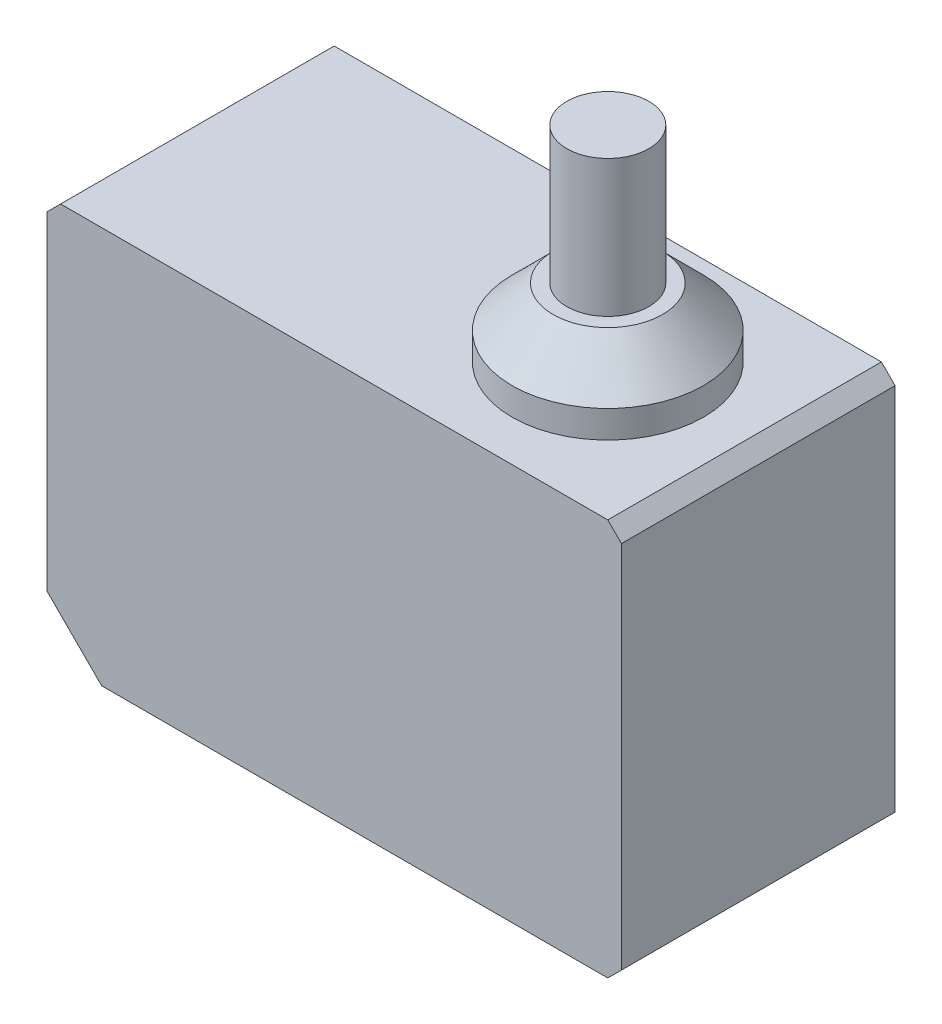
from build123d import *

# Parameters (mm, degrees)
SKETCH1_W           = 42
SKETCH1_H           = 29
BOSS_EXTRUDE1_DEPTH = 20
CHAMFER1_SIZE       = 4
CHAMFER2_SIZE       = 1
CHAMFER3_SIZE       = 1
SKETCH4_R           = 7
BOSS_EXTRUDE2_DEPTH = 5
CHAMFER4_SIZE       = 3
SKETCH5_R           = 3
BOSS_EXTRUDE3_DEPTH = 10


with BuildPart() as part:
    # Sketch1 → Boss-Extrude1 (new body)
    with BuildSketch(Plane.XY):
        with Locations((21, 14.5)):
            Rectangle(SKETCH1_W, SKETCH1_H)
    extrude(amount=BOSS_EXTRUDE1_DEPTH)

    # Chamfer1
    chamfer1_edges = [part.edges().sort_by_distance(p)[0] for p in [
        (0, 0, 10),
    ]]
    chamfer(chamfer1_edges, length=CHAMFER1_SIZE)

    # Chamfer2
    chamfer2_edges = [part.edges().sort_by_distance(p)[0] for p in [
        (0, 29, 10),
        (42, 29, 10),
    ]]
    chamfer(chamfer2_edges, length=CHAMFER2_SIZE)

    # Chamfer3
    chamfer3_edges = [part.edges().sort_by_distance(p)[0] for p in [
        (42, 0, 10),
    ]]
    chamfer(chamfer3_edges, length=CHAMFER3_SIZE)

    # Sketch4 → Boss-Extrude2 (add)
    with BuildSketch(Plane(origin=(0, 29, 0), x_dir=(1, 0, 0), z_dir=(0, 1, 0))):
        with Locations(Location((31, -10, 0), (0, 0, 90))):
            Circle(SKETCH4_R)
    extrude(amount=BOSS_EXTRUDE2_DEPTH)

    # Chamfer4
    chamfer4_edges = [part.edges().sort_by_distance(p)[0] for p in [
        (31, 34, 17),
    ]]
    chamfer(chamfer4_edges, length=CHAMFER4_SIZE)

    # Sketch5 → Boss-Extrude3 (add)
    with BuildSketch(Plane(origin=(0, 34, 0), x_dir=(1, 0, 0), z_dir=(0, 1, 0))):
        with Locations(Location((31, -10, 0), (0, 0, 270))):
            Circle(SKETCH5_R)
    extrude(amount=BOSS_EXTRUDE3_DEPTH)


solid = part.part
